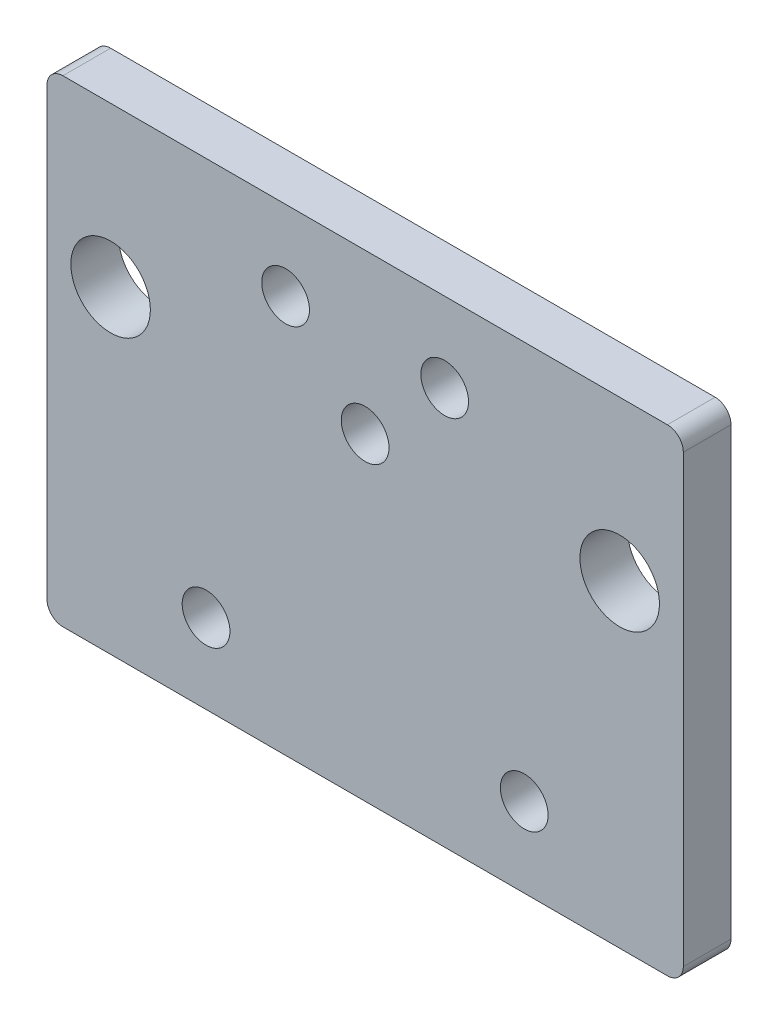
from build123d import *

# Parameters (mm, degrees)
SKETCH_1_W          = 40
SKETCH_1_H          = 20
SKETCH_1_R          = 2.5
EXTRUDE_1_DEPTH     = 3
SKETCH_2_R          = 1.5
CUT_EXTRUDE_1_DEPTH = 3
SKETCH_4_W          = 40
SKETCH_4_H          = 10
EXTRUDE_2_DEPTH     = 3
SKETCH_5_R          = 1.5
CUT_EXTRUDE_2_DEPTH = 10
SKETCH_6_R          = 1.5
CUT_EXTRUDE_3_DEPTH = 10
FILLET_1_R          = 1


with BuildPart() as part:
    # 草图1 → 凸台-拉伸1 (new body)
    with BuildSketch(Plane.XY):
        Rectangle(SKETCH_1_W, SKETCH_1_H)
        with Locations((-16, 0)):
            Circle(SKETCH_1_R, mode=Mode.SUBTRACT)
        with Locations((16, 0)):
            Circle(SKETCH_1_R, mode=Mode.SUBTRACT)
    extrude(amount=EXTRUDE_1_DEPTH)

    # 草图2 → 切除-拉伸1 (cut)
    with BuildSketch(Plane.XY.offset(3)):
        Circle(SKETCH_2_R)
    extrude(amount=-CUT_EXTRUDE_1_DEPTH, mode=Mode.SUBTRACT)

    # 草图4 → 凸台-拉伸2 (add)
    with BuildSketch(Plane.XY.offset(3)):
        with Locations((0, -15)):
            Rectangle(SKETCH_4_W, SKETCH_4_H)
    extrude(amount=-EXTRUDE_2_DEPTH)

    # 草图5 → 切除-拉伸2 (cut)
    with BuildSketch(Plane.XY.offset(3)):
        with Locations((-10, -15)):
            Circle(SKETCH_5_R)
        with Locations((10, -15)):
            Circle(SKETCH_5_R)
    extrude(amount=-CUT_EXTRUDE_2_DEPTH, mode=Mode.SUBTRACT)

    # 草图6 → 切除-拉伸3 (cut)
    with BuildSketch(Plane.XY.offset(3)):
        with Locations((-5, 5)):
            Circle(SKETCH_6_R)
        with Locations((5, 5)):
            Circle(SKETCH_6_R)
    extrude(amount=-CUT_EXTRUDE_3_DEPTH, mode=Mode.SUBTRACT)

    # 圆角1
    fillet_1_edges = [part.edges().sort_by_distance(p)[0] for p in [
        (-20, -20, 1.5),
        (20, -20, 1.5),
        (-20, 10, 1.5),
        (20, 10, 1.5),
    ]]
    fillet(fillet_1_edges, radius=FILLET_1_R)


solid = part.part
